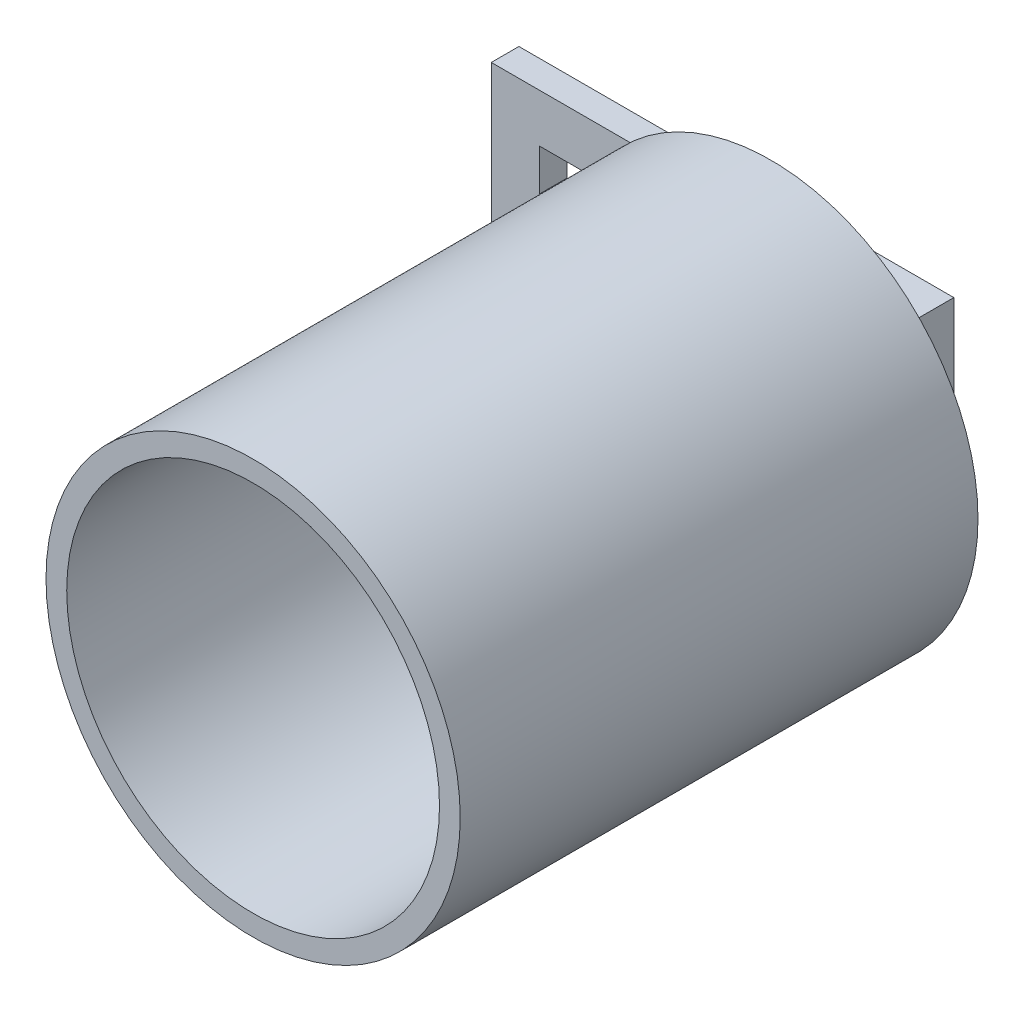
from build123d import *

# Parameters (mm, degrees)
ESQUISSE1_R             = 30
BOSS_EXTRU_1_DEPTH      = 75
ESQUISSE2_R             = 27
ENL_V_MAT_EXTRU_1_DEPTH = 70
ESQUISSE3_W             = 21
ESQUISSE3_H             = 20
BOSS_EXTRU_2_DEPTH      = 16
ESQUISSE4_W             = 4
ESQUISSE4_H             = 20
BOSS_EXTRU_3_DEPTH      = 42
ENL_V_MAT_EXTRU_2_REACH = 111.258
ESQUISSE5_W             = 10
ESQUISSE5_H             = 6


with BuildPart() as part:
    # Esquisse1 → Boss.-Extru.1 (new body)
    with BuildSketch(Plane.XY):
        Circle(ESQUISSE1_R)
    extrude(amount=BOSS_EXTRU_1_DEPTH)

    # Esquisse2 → Enlèv. mat.-Extru.1 (cut)
    with BuildSketch(Plane.XY.offset(75)):
        Circle(ESQUISSE2_R)
    extrude(amount=-ENL_V_MAT_EXTRU_1_DEPTH, mode=Mode.SUBTRACT)

    # Esquisse3 → Boss.-Extru.2 (add)
    with BuildSketch(Plane(origin=(0, 0, 0), x_dir=(-1, 0, 0), z_dir=(0, 0, -1))):
        Rectangle(ESQUISSE3_W, ESQUISSE3_H)
    extrude(amount=BOSS_EXTRU_2_DEPTH)

    # Esquisse4 → Boss.-Extru.3 (add)
    with BuildSketch(Plane.ZY.offset(10.5)):
        with Locations((-14, 0)):
            Rectangle(ESQUISSE4_W, ESQUISSE4_H)
    extrude(amount=BOSS_EXTRU_3_DEPTH)

    # Esquisse5 → Enlèv. mat.-Extru.2 (cut, up to next)
    with BuildSketch(Plane(origin=(0, 0, -16), x_dir=(-1, 0, 0), z_dir=(0, 0, -1)), mode=Mode.PRIVATE) as enl_v_mat_extru_2_sk1:
        with Locations((40.5, 0)):
            Rectangle(ESQUISSE5_W, ESQUISSE5_H)
    enl_v_mat_extru_2_tool1 = extrude(enl_v_mat_extru_2_sk1.sketch, amount=-ENL_V_MAT_EXTRU_2_REACH, mode=Mode.PRIVATE) & part.part
    add(enl_v_mat_extru_2_tool1.solids().sort_by_distance((-40.5, 0, -16))[0], mode=Mode.SUBTRACT)


solid = part.part
